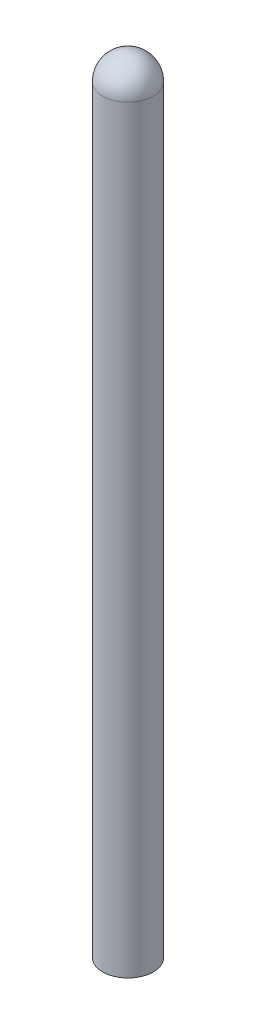
from build123d import *

# Parameters (mm, degrees)
IZIM1_R                     = 5
IZIM1_R_2                   = 3
Y_KSEKLIK_EKSTR_ZYON1_DEPTH = 150
IZIM2_R                     = 5
Y_KSEKLIK_EKSTR_ZYON2_DEPTH = 5
RADYUS1_R                   = 5


with BuildPart() as part:
    # Çizim1 → Yükseklik-Ekstrüzyon1 (new body)
    with BuildSketch(Plane(origin=(0, 0, 0), x_dir=(1, 0, 0), z_dir=(0, 1, 0))):
        with Locations(Location((0, 0, 0), (0, 0, 270))):
            Circle(IZIM1_R)
        with Locations(Location((0, 0, 0), (0, 0, 270))):
            Circle(IZIM1_R_2, mode=Mode.SUBTRACT)
    extrude(amount=Y_KSEKLIK_EKSTR_ZYON1_DEPTH)

    # Çizim2 → Yükseklik-Ekstrüzyon2 (add)
    with BuildSketch(Plane(origin=(0, 150, 0), x_dir=(1, 0, 0), z_dir=(0, 1, 0))):
        with Locations(Location((0, 0, 0), (0, 0, 270))):
            Circle(IZIM2_R)
    extrude(amount=Y_KSEKLIK_EKSTR_ZYON2_DEPTH)

    # Radyus1
    radyus1_edges = [part.edges().sort_by_distance(p)[0] for p in [
        (0, 155, -5),
    ]]
    fillet(radyus1_edges, radius=RADYUS1_R)


solid = part.part
